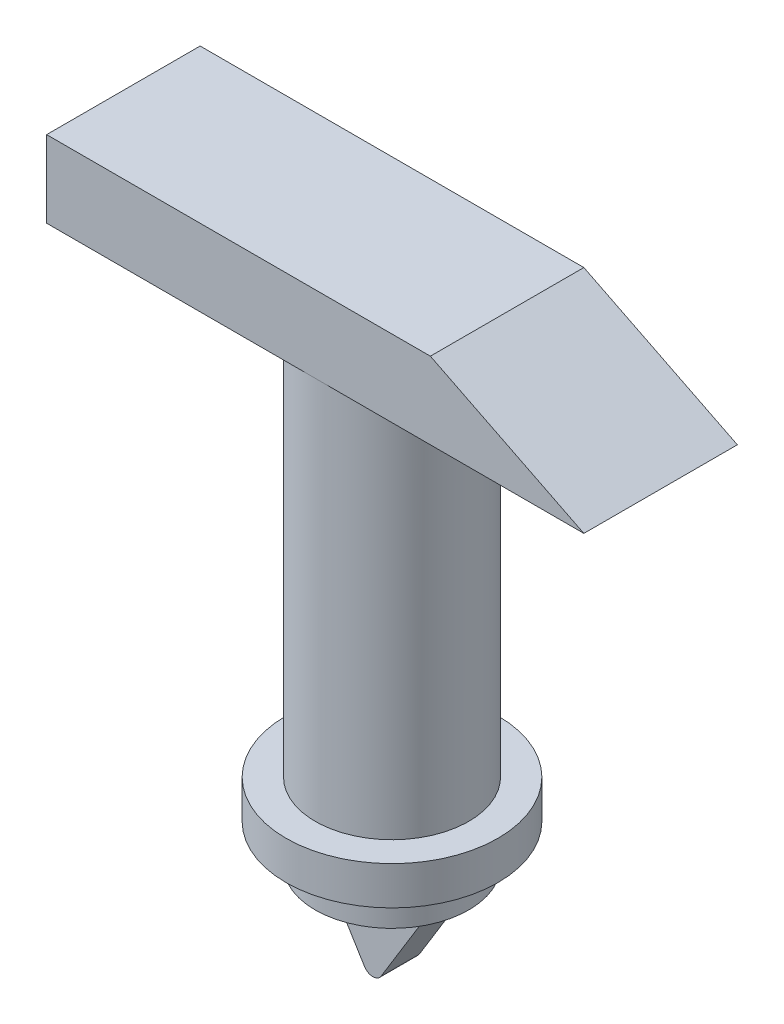
from build123d import *

# Parameters (mm, degrees)
CROQUIS2_R              = 10
SALIENTE_EXTRUIR1_DEPTH = 30
SALIENTE_EXTRUIR2_DEPTH = 2.5
CROQUIS4_W              = 3.81
CROQUIS4_H              = 5
CROQUIS5_W              = 70
CROQUIS5_H              = 20
SALIENTE_EXTRUIR3_DEPTH = 10
CORTAR_EXTRUIR1_DEPTH   = 20


with BuildPart() as part:
    # Croquis2 → Saliente-Extruir1 (new, symmetric)
    with BuildSketch(Plane(origin=(0, 0, 0), x_dir=(1, 0, 0), z_dir=(0, 1, 0))):
        Circle(CROQUIS2_R)
    extrude(amount=SALIENTE_EXTRUIR1_DEPTH, both=True)

    # Croquis3 → Saliente-Extruir2 (add, symmetric)
    with BuildSketch(Plane.XY):
        with BuildLine():
            Line((-1.082739864, -40.663757777), (-7.62, -30))
            Line((-7.62, -30), (7.62, -30))
            Line((7.62, -30), (1.082739864, -40.663757777))
            ThreePointArc((1.082739864, -40.663757777), (0, -41.27), (-1.082739864, -40.663757777))
        make_face()
    extrude(amount=SALIENTE_EXTRUIR2_DEPTH, both=True)

    # Croquis4 → Revolución1 (revolve)
    with BuildSketch(Plane.XY):
        with Locations((11.905, -22.5)):
            Rectangle(CROQUIS4_W, CROQUIS4_H)
    revolve(axis=Axis((0, -30, 0), (0, -1, 0)))

    # Croquis5 → Saliente-Extruir3 (add)
    with BuildSketch(Plane(origin=(0, 30, 0), x_dir=(1, 0, 0), z_dir=(0, 1, 0))):
        Rectangle(CROQUIS5_W, CROQUIS5_H)
    extrude(amount=SALIENTE_EXTRUIR3_DEPTH)

    # Croquis6 → Cortar-Extruir1 (cut)
    with BuildSketch(Plane.XY.offset(10)):
        Polygon((35, 30), (15, 40), (35, 40), align=None)
    extrude(amount=-CORTAR_EXTRUIR1_DEPTH, mode=Mode.SUBTRACT)


solid = part.part
